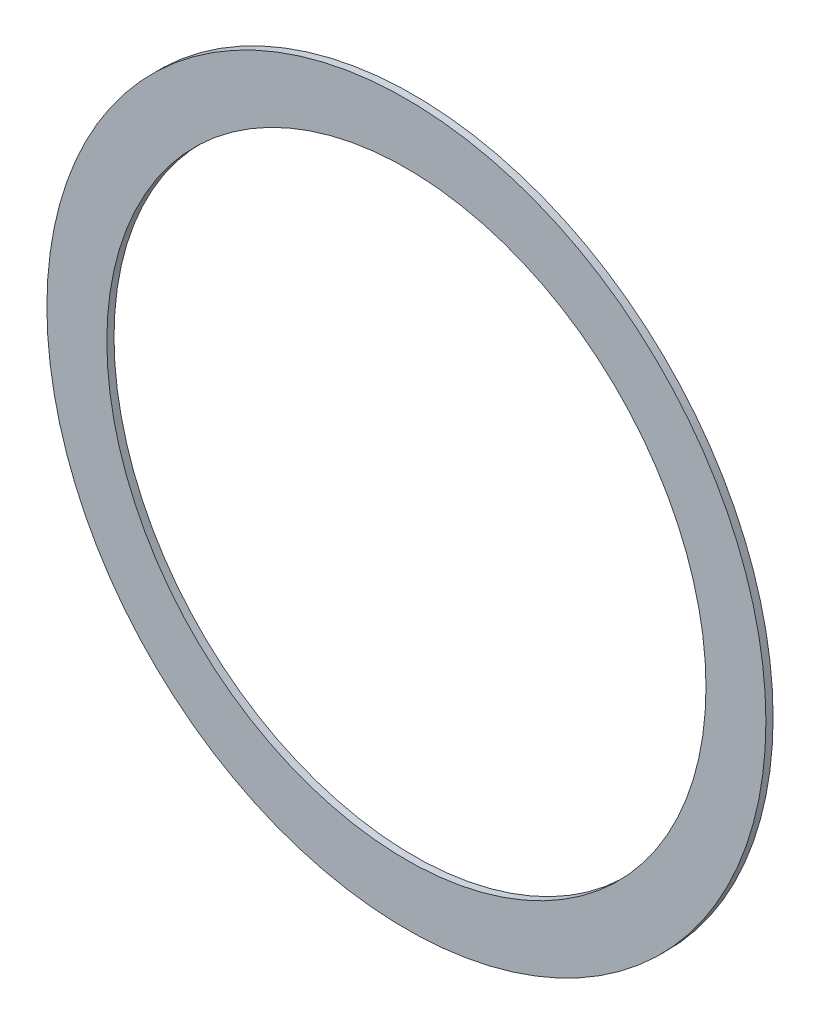
from build123d import *

# Parameters (mm, degrees)
BASE_SKETCH_R      = 19.05
BASE_SKETCH_R_2    = 15.875
BASE_EXTRUDE_DEPTH = 0.381


with BuildPart() as part:
    # Base Sketch → Base Extrude (new body)
    with BuildSketch(Plane.XY):
        Circle(BASE_SKETCH_R)
        Circle(BASE_SKETCH_R_2, mode=Mode.SUBTRACT)
    extrude(amount=-BASE_EXTRUDE_DEPTH)


solid = part.part
